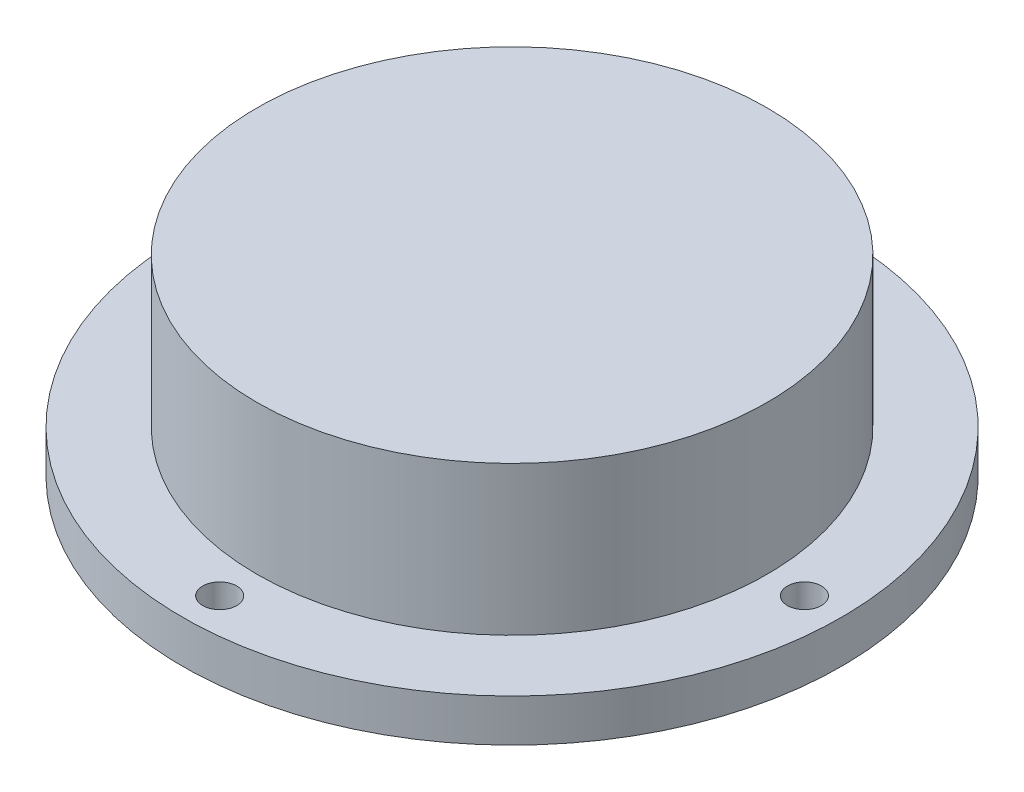
from build123d import *

# Parameters (mm, degrees)
SKETCH1_R                  = 24
BOSS_EXTRUDE1_DEPTH        = 14
SKETCH2_R                  = 19.5
CUT_EXTRUDE1_DEPTH         = 10
SKETCH3_R                  = 6
CUT_EXTRUDE2_DEPTH         = 1.5
SKETCH4_R                  = 31
BOSS_EXTRUDE2_DEPTH        = 4
SKETCH5_R                  = 19.5
CUT_EXTRUDE3_DEPTH         = 4
F_3_2_3_2_DIAMETER_HOLE1_D = 3.2


with BuildPart() as part:
    # Sketch1 → Boss-Extrude1 (new body)
    with BuildSketch(Plane(origin=(0, 0, 0), x_dir=(1, 0, 0), z_dir=(0, 1, 0))):
        with Locations(Location((0, 0, 0), (0, 0, 270))):
            Circle(SKETCH1_R)
    extrude(amount=BOSS_EXTRUDE1_DEPTH)

    # Sketch2 → Cut-Extrude1 (cut)
    with BuildSketch(Plane.XZ):
        with Locations(Location((0, 0, 0), (0, 0, 270))):
            Circle(SKETCH2_R)
    extrude(amount=-CUT_EXTRUDE1_DEPTH, mode=Mode.SUBTRACT)

    # Sketch3 → Cut-Extrude2 (cut)
    with BuildSketch(Plane.XZ.offset(-10)):
        with Locations(Location((0, 0, 0), (0, 0, 270))):
            Circle(SKETCH3_R)
    extrude(amount=-CUT_EXTRUDE2_DEPTH, mode=Mode.SUBTRACT)

    # Sketch4 → Boss-Extrude2 (add)
    with BuildSketch(Plane.XZ):
        with Locations(Location((0, 0, 0), (0, 0, 270))):
            Circle(SKETCH4_R)
    extrude(amount=BOSS_EXTRUDE2_DEPTH)

    # Sketch5 → Cut-Extrude3 (cut)
    with BuildSketch(Plane.XZ.offset(4)):
        with Locations(Location((0, 0, 0), (0, 0, 270))):
            Circle(SKETCH5_R)
    extrude(amount=-CUT_EXTRUDE3_DEPTH, mode=Mode.SUBTRACT)

    # Ø3.2 (3.2) Diameter Hole1 (through all)
    with Locations(Plane(origin=(0, 0, 0), x_dir=(1, 0, 0), z_dir=(0, 1, 0))):
        with Locations((-27.5, 0), (0, 27.5), (27.5, 0), (0, -27.5)):
            Hole(F_3_2_3_2_DIAMETER_HOLE1_D / 2)


solid = part.part
